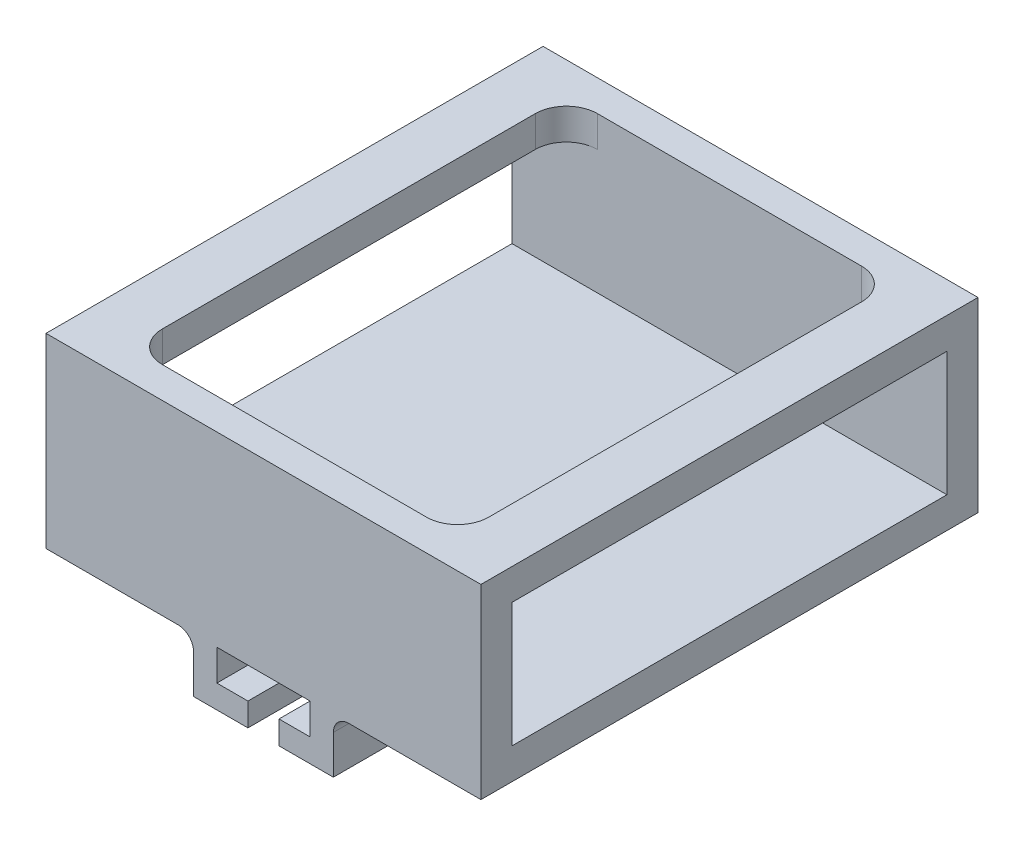
from build123d import *

# Parameters (mm, degrees)
SKETCH_1_W          = 28
SKETCH_1_H          = 12
SKETCH_1_W_2        = 9
SKETCH_1_H_2        = 3.5
EXTRUDE_1_DEPTH     = 32
SKETCH_2_W          = 1
SKETCH_2_H          = 1.5
CUT_EXTRUDE_1_DEPTH = 37.197375595
SKETCH_3_W          = 2
SKETCH_3_H          = 1
CUT_EXTRUDE_2_DEPTH = 39.164119275
FILLET_1_R          = 1
SKETCH_6_W          = 28
SKETCH_6_H          = 8
CUT_EXTRUDE_5_DEPTH = 44.568910934
CUT_EXTRUDE_4_REACH = 40.213
SKETCH_5_W          = 21
SKETCH_5_H          = 28
FILLET_2_R          = 2


with BuildPart() as part:
    # 草图1 → 凸台-拉伸1 (new body)
    with BuildSketch(Plane.XY):
        Rectangle(SKETCH_1_W, SKETCH_1_H)
        with Locations((0, -7.75)):
            Rectangle(SKETCH_1_W_2, SKETCH_1_H_2)
    extrude(amount=EXTRUDE_1_DEPTH)

    # 草图2 → 切除-拉伸1 (cut, through all)
    with BuildSketch(Plane(origin=(0, 0, 0), x_dir=(-1, 0, 0), z_dir=(0, 0, -1))):
        Polygon((0, -6), (-3, -6), (-3, -8), (-1, -8), (0, -8), align=None)
        Polygon((3, -6), (0, -6), (0, -8), (1, -8), (3, -8), align=None)
        with Locations((-0.5, -8.75)):
            Rectangle(SKETCH_2_W, SKETCH_2_H)
        with Locations((0.5, -8.75)):
            Rectangle(SKETCH_2_W, SKETCH_2_H)
    extrude(amount=-CUT_EXTRUDE_1_DEPTH, mode=Mode.SUBTRACT)

    # 草图3 → 切除-拉伸2 (cut, through all)
    with BuildSketch(Plane.ZY.offset(4.5)):
        with Locations((9, -9)):
            Rectangle(SKETCH_3_W, SKETCH_3_H)
        with Locations((23, -9)):
            Rectangle(SKETCH_3_W, SKETCH_3_H)
    extrude(amount=-CUT_EXTRUDE_2_DEPTH, mode=Mode.SUBTRACT)

    # 圆角1
    fillet_1_edges = [part.edges().sort_by_distance(p)[0] for p in [
        (4.5, -6, 16),
        (-4.5, -6, 16),
    ]]
    fillet(fillet_1_edges, radius=FILLET_1_R)

    # 草图6 → 切除-拉伸5 (cut, through all)
    with BuildSketch(Plane(origin=(14, 0, 0), x_dir=(0, 0, -1), z_dir=(1, 0, 0))):
        with Locations((-16, 0)):
            Rectangle(SKETCH_6_W, SKETCH_6_H)
    extrude(amount=-CUT_EXTRUDE_5_DEPTH, mode=Mode.SUBTRACT)

    # 草图5 → 切除-拉伸4 (cut, up to next)
    with BuildSketch(Plane(origin=(0, 6, 0), x_dir=(1, 0, 0), z_dir=(0, 1, 0)), mode=Mode.PRIVATE) as cut_extrude_4_sk1:
        with Locations((0, -16)):
            Rectangle(SKETCH_5_W, SKETCH_5_H)
    cut_extrude_4_tool1 = extrude(cut_extrude_4_sk1.sketch, amount=-CUT_EXTRUDE_4_REACH, mode=Mode.PRIVATE) & part.part
    add(cut_extrude_4_tool1.solids().sort_by_distance((0, 6, 16))[0], mode=Mode.SUBTRACT)

    # 圆角2
    fillet_2_edges = [part.edges().sort_by_distance(p)[0] for p in [
        (10.5, 5, 30),
        (10.5, 5, 2),
        (-10.5, 5, 2),
        (-10.5, 5, 30),
    ]]
    fillet(fillet_2_edges, radius=FILLET_2_R)


solid = part.part
